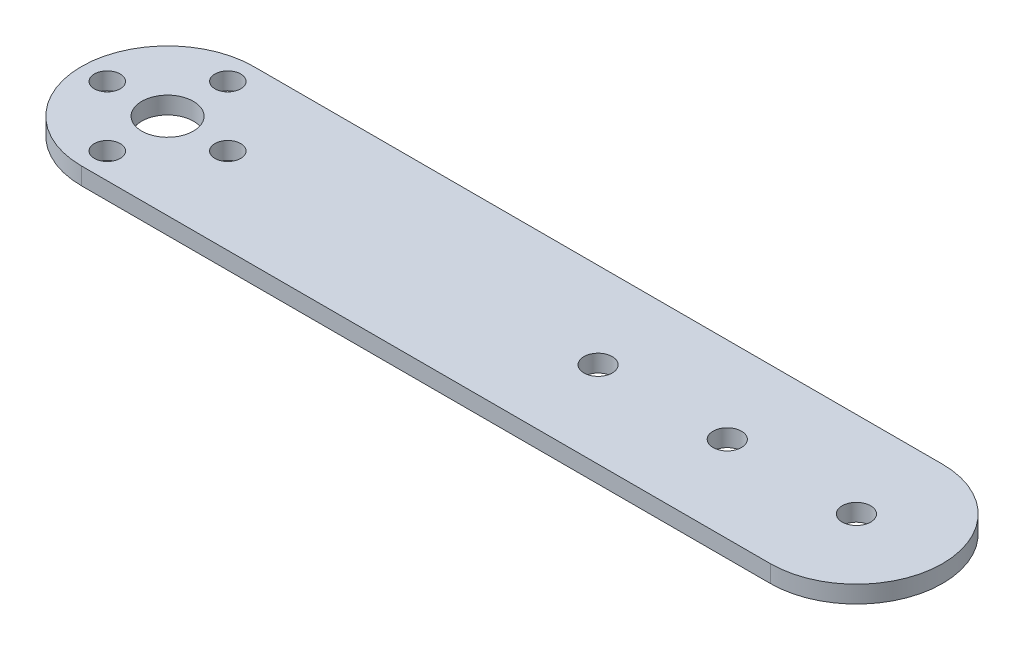
from build123d import *

# Parameters (mm, degrees)
SKETCH_1_R      = 1.5
SKETCH_1_R_2    = 1.65
SKETCH_1_R_3    = 3
EXTRUDE_1_DEPTH = 2


with BuildPart() as part:
    # Эскиз1 → Бобышка-Вытянуть1 (new body)
    with BuildSketch(Plane(origin=(0, 0, 0), x_dir=(1, 0, 0), z_dir=(0, 1, 0))):
        with BuildLine():
            Line((0, 10), (80, 10))
            ThreePointArc((80, 10), (90, 0), (80, -10))
            Line((80, -10), (0, -10))
            ThreePointArc((0, -10), (-10, 0), (0, 10))
        make_face()
        with Locations(Location((0, 7, 0), (0, 0, 270))):
            Circle(SKETCH_1_R, mode=Mode.SUBTRACT)
        with Locations(Location((7, 0, 0), (0, 0, 270))):
            Circle(SKETCH_1_R, mode=Mode.SUBTRACT)
        with Locations(Location((0, -7, 0), (0, 0, 270))):
            Circle(SKETCH_1_R, mode=Mode.SUBTRACT)
        with Locations(Location((-7, 0, 0), (0, 0, 270))):
            Circle(SKETCH_1_R, mode=Mode.SUBTRACT)
        with Locations(Location((80, 0, 0), (0, 0, 270))):
            Circle(SKETCH_1_R_2, mode=Mode.SUBTRACT)
        with Locations(Location((50, 0, 0), (0, 0, 270))):
            Circle(SKETCH_1_R_2, mode=Mode.SUBTRACT)
        with Locations(Location((65, 0, 0), (0, 0, 270))):
            Circle(SKETCH_1_R_2, mode=Mode.SUBTRACT)
        with Locations(Location((0, 0, 0), (0, 0, 270))):
            Circle(SKETCH_1_R_3, mode=Mode.SUBTRACT)
    extrude(amount=EXTRUDE_1_DEPTH)


solid = part.part
